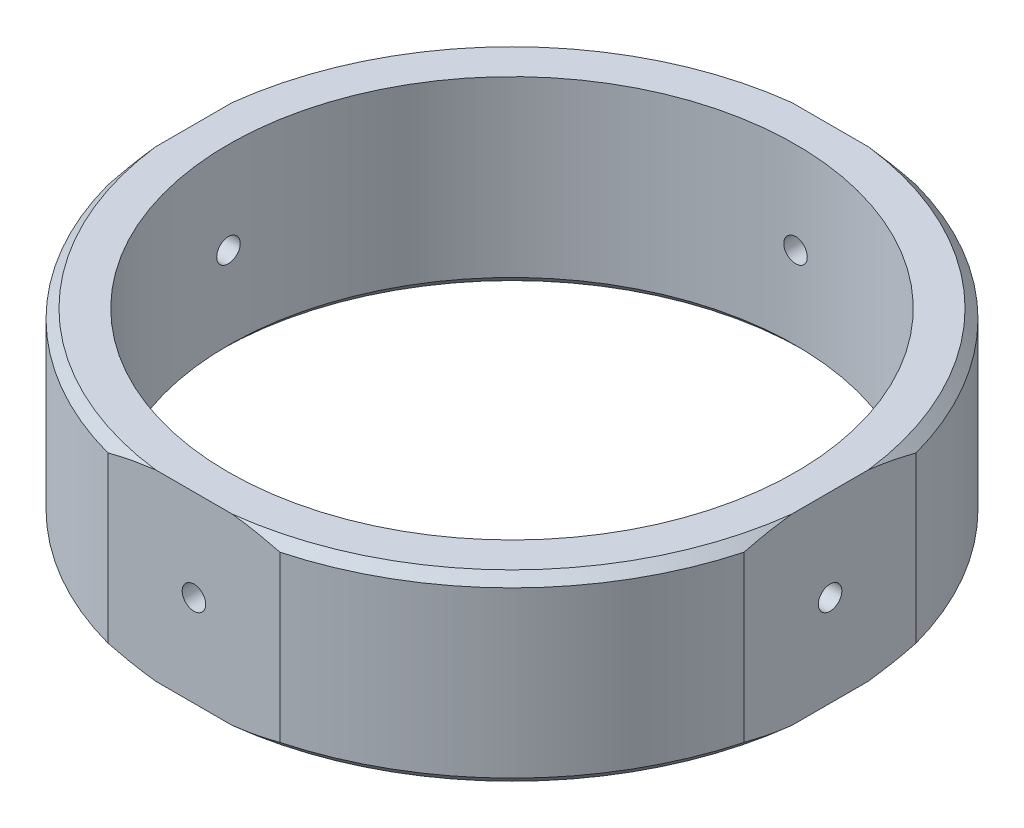
from build123d import *

# Parameters (mm, degrees)
SKETCH1_R           = 91.44
SKETCH1_R_2         = 78.74
BOSS_EXTRUDE1_DEPTH = 50.8
CHAMFER1_SIZE       = 2.54
SKETCH2_W           = 16.258151814
SKETCH2_H           = 87.529352209
CUT_EXTRUDE1_DEPTH  = 127
CIRPATTERN1_COUNT   = 4
SKETCH3_R           = 3.2639
CUT_EXTRUDE2_DEPTH  = 204.799389413
CIRPATTERN2_COUNT   = 4


with BuildPart() as part:
    # Sketch1 → Boss-Extrude1 (new body)
    with BuildSketch(Plane(origin=(0, 0, 0), x_dir=(1, 0, 0), z_dir=(0, 1, 0))):
        with Locations(Location((0, 0, 0), (0, 0, 270))):
            Circle(SKETCH1_R)
        with Locations(Location((0, 0, 0), (0, 0, 270))):
            Circle(SKETCH1_R_2, mode=Mode.SUBTRACT)
    extrude(amount=BOSS_EXTRUDE1_DEPTH)

    # Chamfer1
    chamfer1_edges = [part.edges().sort_by_distance(p)[0] for p in [
        (0, 0, -91.44),
        (0, 50.8, -91.44),
        (0, 0, -78.74),
    ]]
    chamfer(chamfer1_edges, length=CHAMFER1_SIZE)

    # Sketch2 → Cut-Extrude1 (cut, symmetric)
    with BuildSketch(Plane.XY):
        with Locations((96.394075907, 25.589048277)):
            Rectangle(SKETCH2_W, SKETCH2_H)
    cut_extrude1 = extrude(amount=CUT_EXTRUDE1_DEPTH, both=True, mode=Mode.SUBTRACT)

    # CirPattern1: Cut-Extrude1 ×4 about axis
    cirpattern1_axis = Axis((0, 0, 0), (0, 1, 0))
    for i in range(1, CIRPATTERN1_COUNT):
        add(cut_extrude1.rotate(cirpattern1_axis, i * 360 / CIRPATTERN1_COUNT), mode=Mode.SUBTRACT)

    # Sketch3 → Cut-Extrude2 (cut, through all)
    with BuildSketch(Plane(origin=(0, 0, -88.265), x_dir=(-1, 0, 0), z_dir=(0, 0, -1))):
        with Locations((3.65e-06, 25.4)):
            Circle(SKETCH3_R)
    cut_extrude2 = extrude(amount=-CUT_EXTRUDE2_DEPTH, mode=Mode.SUBTRACT)

    # CirPattern2: Cut-Extrude2 ×4 about axis
    cirpattern2_axis = Axis((0, 50.8, 0), (0, 1, 0))
    for i in range(1, CIRPATTERN2_COUNT):
        add(cut_extrude2.rotate(cirpattern2_axis, i * 360 / CIRPATTERN2_COUNT), mode=Mode.SUBTRACT)


solid = part.part
